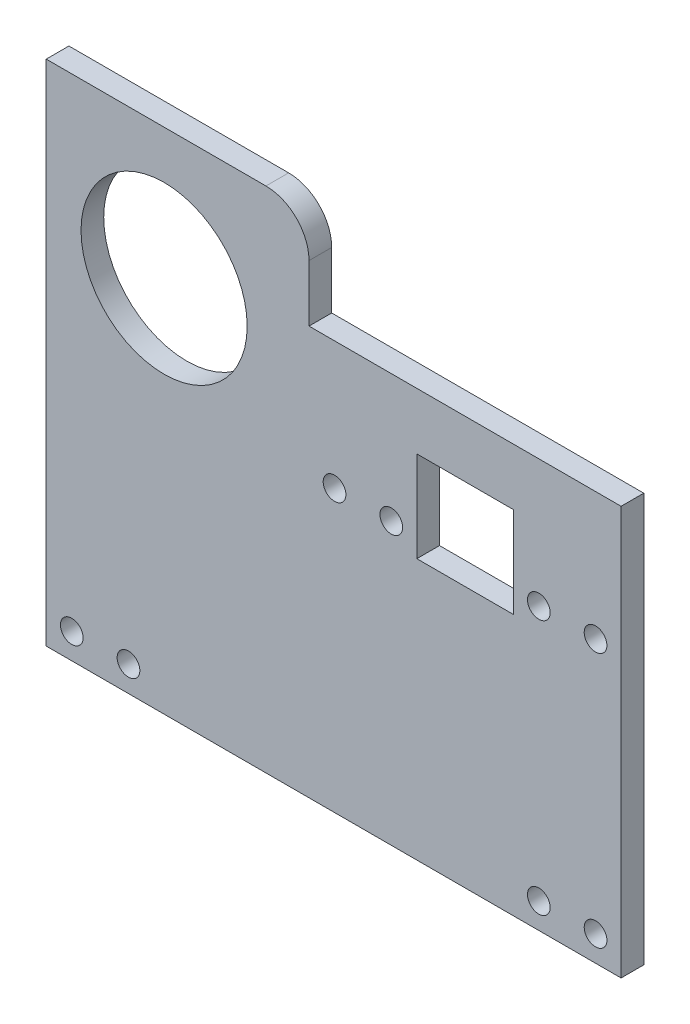
from build123d import *

# Parameters (mm, degrees)
SKETCH1_R           = 14.641801201
BOSS_EXTRUDE1_DEPTH = 4
SKETCH2_R           = 2
CUT_EXTRUDE1_DEPTH  = 16
SKETCH3_W           = 17
SKETCH3_H           = 16
CUT_EXTRUDE2_DEPTH  = 7


with BuildPart() as part:
    # Sketch1 → Boss-Extrude1 (new body)
    with BuildSketch(Plane(origin=(0, 0, 0), x_dir=(-1, 0, 0), z_dir=(0, 0, 1))):
        with BuildLine():
            Line((8.946512726, 42.193608765), (-46.053487274, 42.193608765))
            Line((-46.053487274, 42.193608765), (-46.053487274, 114.193608765))
            Line((-46.053487274, 114.193608765), (55.263162893, 114.193608765))
            Line((55.263162893, 114.193608765), (55.263162893, 24.601563698))
            Line((55.263162893, 24.601563698), (16.538557793, 24.601563698))
            ThreePointArc((16.538557793, 24.601563698), (11.170171243, 26.825222215), (8.946512726, 32.193608765))
            Line((8.946512726, 32.193608765), (8.946512726, 42.193608765))
        make_face()
        with Locations(Location((34.486512726, 47.671563698, 0), (0, 0, 180))):
            Circle(SKETCH1_R, mode=Mode.SUBTRACT)
    extrude(amount=BOSS_EXTRUDE1_DEPTH)

    # Sketch2 → Cut-Extrude1 (cut)
    with BuildSketch(Plane.XY.offset(4)):
        with Locations((41.553487274, -109.693608765)):
            Circle(SKETCH2_R)
        with Locations((31.553487274, -109.693608765)):
            Circle(SKETCH2_R)
        with Locations((-50.763162893, -109.693608765)):
            Circle(SKETCH2_R)
        with Locations((-40.763162893, -109.693608765)):
            Circle(SKETCH2_R)
        with Locations((41.553487274, -64.693608765)):
            Circle(SKETCH2_R)
        with Locations((31.553487274, -64.693608765)):
            Circle(SKETCH2_R)
        with Locations((-4.446512726, -64.693608765)):
            Circle(SKETCH2_R)
        with Locations((5.553487274, -64.693608765)):
            Circle(SKETCH2_R)
    extrude(amount=-CUT_EXTRUDE1_DEPTH, mode=Mode.SUBTRACT)

    # Sketch3 → Cut-Extrude2 (cut)
    with BuildSketch(Plane.XY.offset(4)):
        with Locations((18.553487274, -60.193608765)):
            Rectangle(SKETCH3_W, SKETCH3_H)
    extrude(amount=-CUT_EXTRUDE2_DEPTH, mode=Mode.SUBTRACT)


solid = part.part
